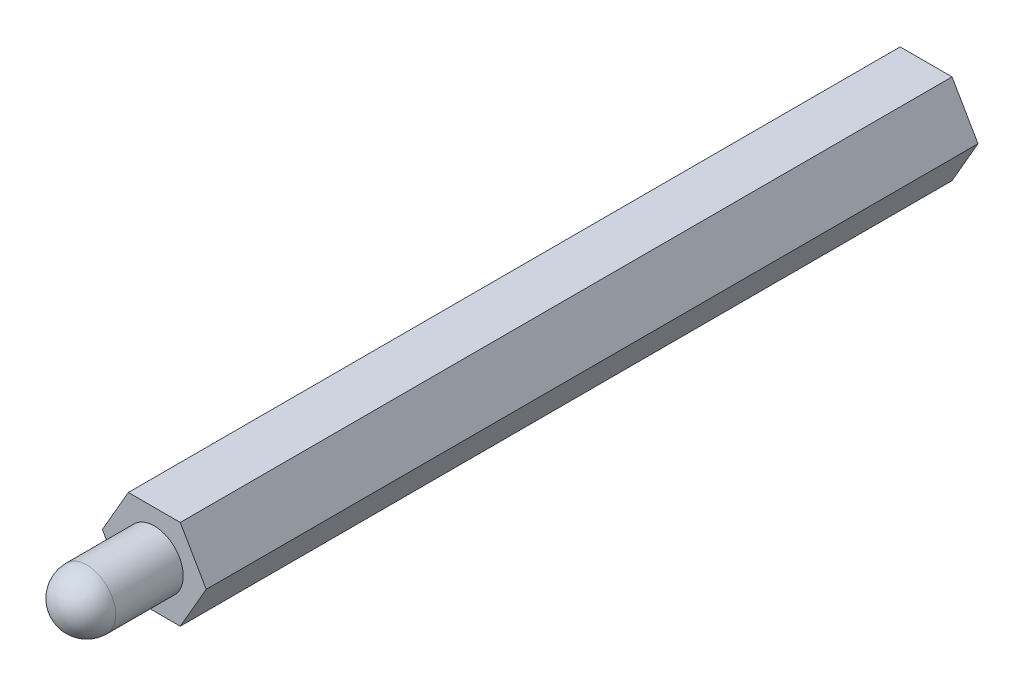
from build123d import *

# Parameters (mm, degrees)
EXTRUDE_1_DEPTH = 40
SKETCH_2_R      = 1.5
EXTRUDE_2_DEPTH = 5
FILLET_1_R      = 1.5


with BuildPart() as part:
    # 草图1 → 凸台-拉伸1 (new body)
    with BuildSketch(Plane.XY):
        Polygon((2.690452254, 0), (1.345226127, 2.33), (-1.345226127, 2.33), (-2.690452254, 0), (-1.345226127, -2.33), (1.345226127, -2.33), align=None)
    extrude(amount=EXTRUDE_1_DEPTH)

    # 草图2 → 凸台-拉伸2 (add)
    with BuildSketch(Plane.XY.offset(40)):
        Circle(SKETCH_2_R)
    extrude(amount=EXTRUDE_2_DEPTH)

    # 圆角1
    fillet_1_edges = [part.edges().sort_by_distance(p)[0] for p in [
        (-1.5, 0, 45),
    ]]
    fillet(fillet_1_edges, radius=FILLET_1_R)


solid = part.part
